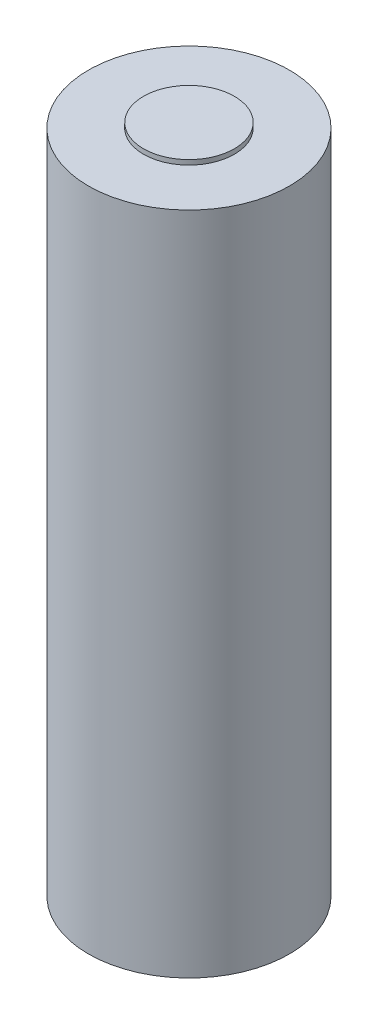
from build123d import *

# Parameters (mm, degrees)
SKETCH1_R           = 10.5
BOSS_EXTRUDE1_DEPTH = 70
CUT_EXTRUDE1_START  = -0.5
SKETCH2_R           = 10.5
SKETCH2_R_2         = 4.75
CUT_EXTRUDE1_DEPTH  = 0.5


with BuildPart() as part:
    # Sketch1 → Boss-Extrude1 (new body)
    with BuildSketch(Plane(origin=(0, 0, 0), x_dir=(1, 0, 0), z_dir=(0, 1, 0))):
        with Locations(Location((0, 0, 0), (0, 0, 270))):
            Circle(SKETCH1_R)
    extrude(amount=BOSS_EXTRUDE1_DEPTH)

    # Sketch2 → Cut-Extrude1 (cut)
    with BuildSketch(Plane(origin=(0, 70, 0), x_dir=(1, 0, 0), z_dir=(0, 1, 0)).offset(CUT_EXTRUDE1_START)):
        with Locations(Location((0, 0, 0), (0, 0, 270))):
            Circle(SKETCH2_R)
        with Locations(Location((0, 0, 0), (0, 0, 270))):
            Circle(SKETCH2_R_2, mode=Mode.SUBTRACT)
    extrude(amount=CUT_EXTRUDE1_DEPTH, mode=Mode.SUBTRACT)


solid = part.part
